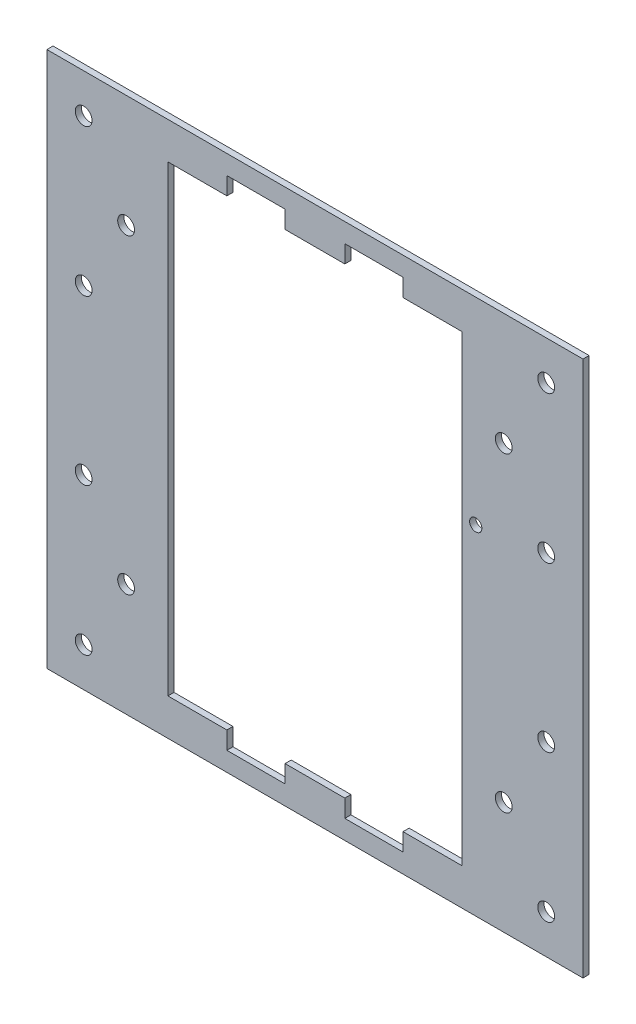
from build123d import *

# Parameters (mm, degrees)
SKETCH_1_W                      = 700
SKETCH_1_H                      = 700
CONNECTION_PLATE_DEPTH          = 8
SKETCH_2_W                      = 76
SKETCH_2_H                      = 300
ACCESS_WINDOW_DEPTH             = 990.981818015
SKETCH_3_W                      = 76
SKETCH_3_H                      = 300
CUT_EXTRUDE_2_DEPTH             = 990.981818015
SKETCH_4_W                      = 76
SKETCH_4_H                      = 300
CUT_EXTRUDE_3_DEPTH             = 990.981818015
SKETCH_5_W                      = 76
SKETCH_5_H                      = 300
CUT_EXTRUDE_4_DEPTH             = 990.981818015
SKETCH_6_R                      = 11
SHAFT_CLEARANCE_DEPTH           = 990.981818015
SKETCH_7_R                      = 11
CUT_EXTRUDE_6_DEPTH             = 990.981818015
SKETCH_8_R                      = 11
CUT_EXTRUDE_7_DEPTH             = 990.981818015
SKETCH_9_R                      = 11
CUT_EXTRUDE_8_DEPTH             = 990.981818015
SKETCH_10_R                     = 11
CUT_EXTRUDE_9_DEPTH             = 990.981818015
SKETCH_11_R                     = 11
CUT_EXTRUDE_10_DEPTH            = 990.981818015
SKETCH_12_R                     = 11
CUT_EXTRUDE_11_DEPTH            = 990.981818015
SKETCH_13_R                     = 11
CUT_EXTRUDE_12_DEPTH            = 990.981818015
SKETCH_14_R                     = 11
CUT_EXTRUDE_13_DEPTH            = 990.981818015
SKETCH_15_R                     = 11
CUT_EXTRUDE_14_DEPTH            = 990.981818015
SKETCH_16_R                     = 11
CUT_EXTRUDE_15_DEPTH            = 990.981818015
SKETCH_17_R                     = 11
CUT_EXTRUDE_16_DEPTH            = 990.981818015
SKETCH_18_W                     = 384
SKETCH_18_H                     = 604
FLOAT_INSTALLATION_WINDOW_DEPTH = 990.981818015
SKETCH_19_R                     = 8
COMMS_PASSAGE_DEPTH             = 990.981818015


with BuildPart() as part:
    # 草图1 → Connection_plate (new body)
    with BuildSketch(Plane.XY):
        with Locations((350, 350)):
            Rectangle(SKETCH_1_W, SKETCH_1_H)
    extrude(amount=CONNECTION_PLATE_DEPTH)

    # 草图2 → Access_window (cut, through all)
    with BuildSketch(Plane.XY.offset(8)):
        with Locations((273, 175)):
            Rectangle(SKETCH_2_W, SKETCH_2_H)
    extrude(amount=-ACCESS_WINDOW_DEPTH, mode=Mode.SUBTRACT)

    # 草图3 → 切除-拉伸2 (cut, through all)
    with BuildSketch(Plane.XY.offset(8)):
        with Locations((273, 525)):
            Rectangle(SKETCH_3_W, SKETCH_3_H)
    extrude(amount=-CUT_EXTRUDE_2_DEPTH, mode=Mode.SUBTRACT)

    # 草图4 → 切除-拉伸3 (cut, through all)
    with BuildSketch(Plane.XY.offset(8)):
        with Locations((427, 175)):
            Rectangle(SKETCH_4_W, SKETCH_4_H)
    extrude(amount=-CUT_EXTRUDE_3_DEPTH, mode=Mode.SUBTRACT)

    # 草图5 → 切除-拉伸4 (cut, through all)
    with BuildSketch(Plane.XY.offset(8)):
        with Locations((427, 525)):
            Rectangle(SKETCH_5_W, SKETCH_5_H)
    extrude(amount=-CUT_EXTRUDE_4_DEPTH, mode=Mode.SUBTRACT)

    # 草图6 → Shaft_clearance (cut, through all)
    with BuildSketch(Plane.XY.offset(8)):
        with Locations((48, 51)):
            Circle(SKETCH_6_R)
    extrude(amount=-SHAFT_CLEARANCE_DEPTH, mode=Mode.SUBTRACT)

    # 草图7 → 切除-拉伸6 (cut, through all)
    with BuildSketch(Plane.XY.offset(8)):
        with Locations((48, 243)):
            Circle(SKETCH_7_R)
    extrude(amount=-CUT_EXTRUDE_6_DEPTH, mode=Mode.SUBTRACT)

    # 草图8 → 切除-拉伸7 (cut, through all)
    with BuildSketch(Plane.XY.offset(8)):
        with Locations((48, 457)):
            Circle(SKETCH_8_R)
    extrude(amount=-CUT_EXTRUDE_7_DEPTH, mode=Mode.SUBTRACT)

    # 草图9 → 切除-拉伸8 (cut, through all)
    with BuildSketch(Plane.XY.offset(8)):
        with Locations((48, 649)):
            Circle(SKETCH_9_R)
    extrude(amount=-CUT_EXTRUDE_8_DEPTH, mode=Mode.SUBTRACT)

    # 草图10 → 切除-拉伸9 (cut, through all)
    with BuildSketch(Plane.XY.offset(8)):
        with Locations((103.43, 147)):
            Circle(SKETCH_10_R)
    extrude(amount=-CUT_EXTRUDE_9_DEPTH, mode=Mode.SUBTRACT)

    # 草图11 → 切除-拉伸10 (cut, through all)
    with BuildSketch(Plane.XY.offset(8)):
        with Locations((103.43, 553)):
            Circle(SKETCH_11_R)
    extrude(amount=-CUT_EXTRUDE_10_DEPTH, mode=Mode.SUBTRACT)

    # 草图12 → 切除-拉伸11 (cut, through all)
    with BuildSketch(Plane.XY.offset(8)):
        with Locations((652, 51)):
            Circle(SKETCH_12_R)
    extrude(amount=-CUT_EXTRUDE_11_DEPTH, mode=Mode.SUBTRACT)

    # 草图13 → 切除-拉伸12 (cut, through all)
    with BuildSketch(Plane.XY.offset(8)):
        with Locations((652, 243)):
            Circle(SKETCH_13_R)
    extrude(amount=-CUT_EXTRUDE_12_DEPTH, mode=Mode.SUBTRACT)

    # 草图14 → 切除-拉伸13 (cut, through all)
    with BuildSketch(Plane.XY.offset(8)):
        with Locations((652, 457)):
            Circle(SKETCH_14_R)
    extrude(amount=-CUT_EXTRUDE_13_DEPTH, mode=Mode.SUBTRACT)

    # 草图15 → 切除-拉伸14 (cut, through all)
    with BuildSketch(Plane.XY.offset(8)):
        with Locations((652, 649)):
            Circle(SKETCH_15_R)
    extrude(amount=-CUT_EXTRUDE_14_DEPTH, mode=Mode.SUBTRACT)

    # 草图16 → 切除-拉伸15 (cut, through all)
    with BuildSketch(Plane.XY.offset(8)):
        with Locations((596.57, 147)):
            Circle(SKETCH_16_R)
    extrude(amount=-CUT_EXTRUDE_15_DEPTH, mode=Mode.SUBTRACT)

    # 草图17 → 切除-拉伸16 (cut, through all)
    with BuildSketch(Plane.XY.offset(8)):
        with Locations((596.57, 553)):
            Circle(SKETCH_17_R)
    extrude(amount=-CUT_EXTRUDE_16_DEPTH, mode=Mode.SUBTRACT)

    # 草图18 → Float_installation_window (cut, through all)
    with BuildSketch(Plane.XY.offset(8)):
        with Locations((350, 350)):
            Rectangle(SKETCH_18_W, SKETCH_18_H)
    extrude(amount=-FLOAT_INSTALLATION_WINDOW_DEPTH, mode=Mode.SUBTRACT)

    # 草图19 → Comms_passage (cut, through all)
    with BuildSketch(Plane.XY.offset(8)):
        with Locations((560, 442.45)):
            Circle(SKETCH_19_R)
    extrude(amount=-COMMS_PASSAGE_DEPTH, mode=Mode.SUBTRACT)


solid = part.part
